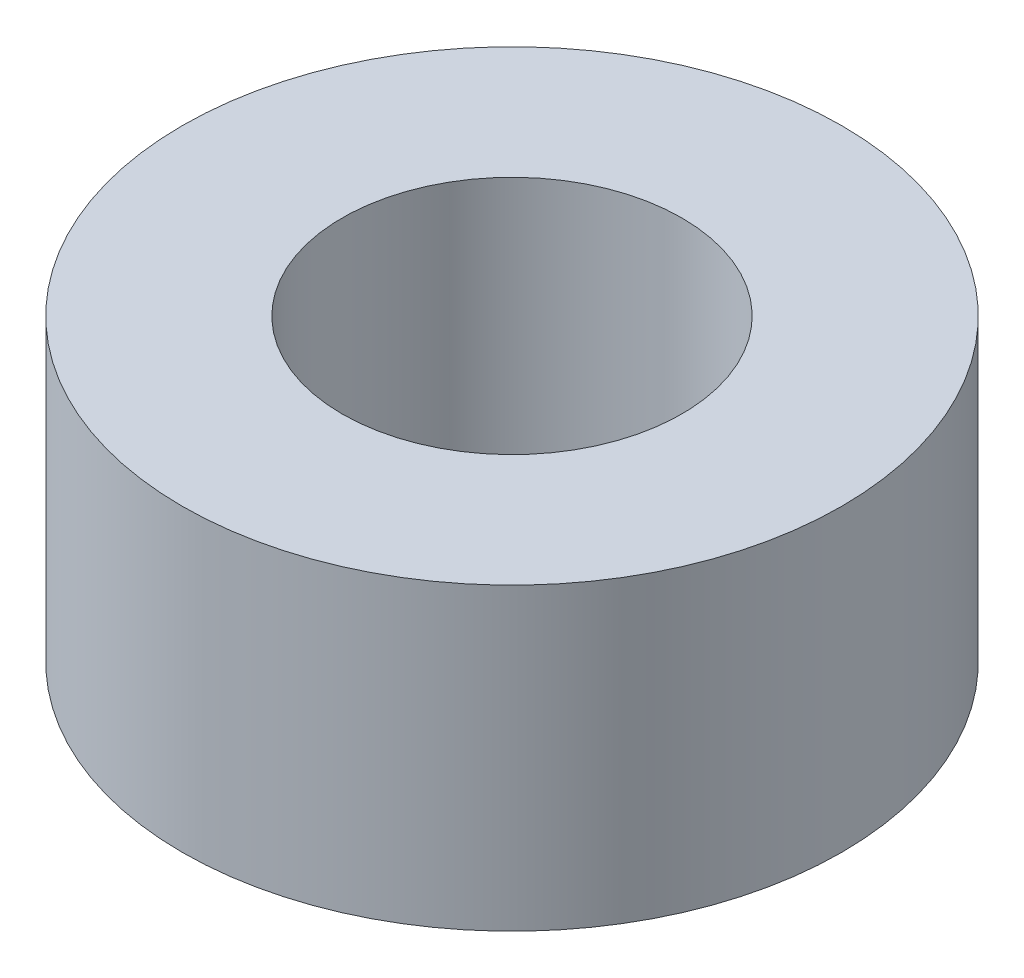
from build123d import *

# Parameters (mm, degrees)
SKETCH1_R            = 3.3
BOSS_EXTRUDE1_DEPTH  = 3
M3_CLEARANCE_HOLE1_D = 3.4


with BuildPart() as part:
    # Sketch1 → Boss-Extrude1 (new body)
    with BuildSketch(Plane(origin=(0, 0, 0), x_dir=(1, 0, 0), z_dir=(0, 1, 0))):
        with Locations(Location((0, 0, 0), (0, 0, 270))):
            Circle(SKETCH1_R)
    extrude(amount=BOSS_EXTRUDE1_DEPTH)

    # M3 Clearance Hole1 (through all)
    with Locations(Plane(origin=(0, 3, 0), x_dir=(1, 0, 0), z_dir=(0, 1, 0))):
        with Locations((0, 0)):
            Hole(M3_CLEARANCE_HOLE1_D / 2)


solid = part.part
